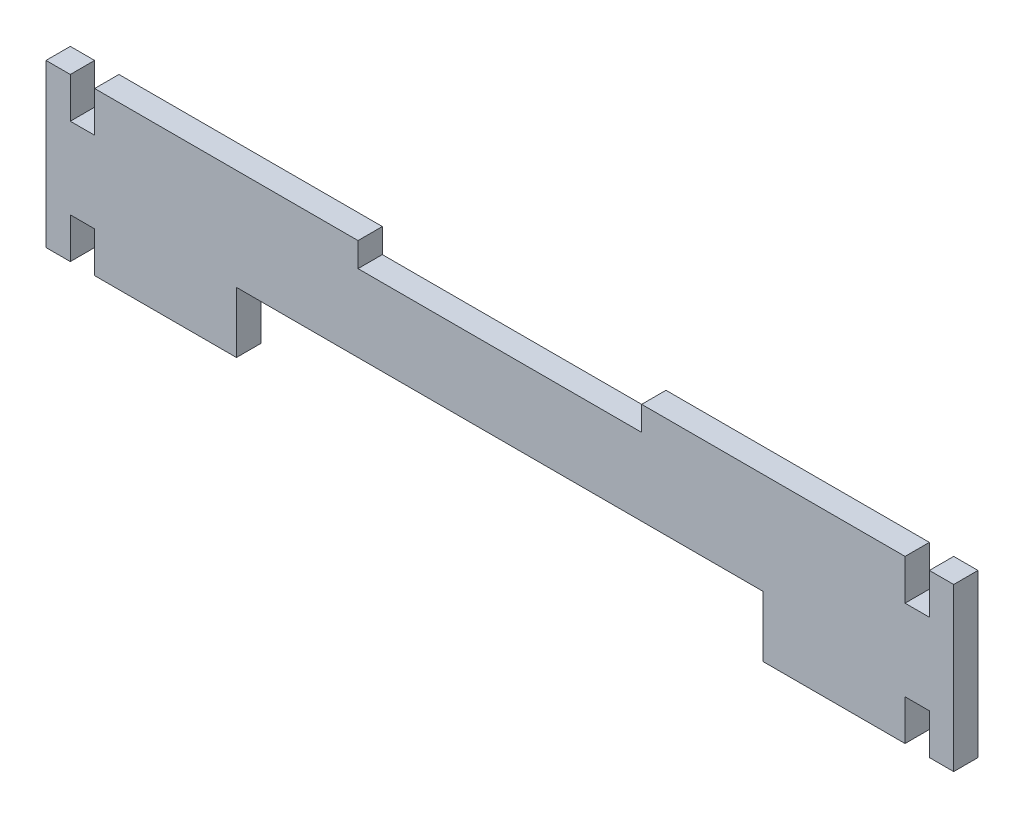
from build123d import *

# Parameters (mm, degrees)
SKETCH1_W            = 224
SKETCH1_H            = 40
BOSS_EXTRUDE1_DEPTH  = 6
SKETCH2_W            = 6
SKETCH2_H            = 10
CUT_EXTRUDE1_DEPTH   = 228.622494495
LPATTERN1_COUNT      = 2
LPATTERN1_PITCH      = 206
LPATTERN1_COUNT_DIR2 = 2
LPATTERN1_PITCH_DIR2 = 30
SKETCH3_W            = 70
SKETCH3_H            = 6
CUT_EXTRUDE2_DEPTH   = 228.622494495
SKETCH4_W            = 130
SKETCH4_H            = 15
CUT_EXTRUDE3_DEPTH   = 10


with BuildPart() as part:
    # Sketch1 → Boss-Extrude1 (new body)
    with BuildSketch(Plane.XY):
        with Locations((-112, 20)):
            Rectangle(SKETCH1_W, SKETCH1_H)
    extrude(amount=BOSS_EXTRUDE1_DEPTH)

    # Sketch2 → Cut-Extrude1 (cut, through all)
    with BuildSketch(Plane.XY.offset(6)):
        with Locations((-215, 35)):
            Rectangle(SKETCH2_W, SKETCH2_H)
    cut_extrude1 = extrude(amount=-CUT_EXTRUDE1_DEPTH, mode=Mode.SUBTRACT)

    # LPattern1: Cut-Extrude1 2 × 2
    with Locations(*[(i * LPATTERN1_PITCH, -j * LPATTERN1_PITCH_DIR2, 0) for i in range(LPATTERN1_COUNT) for j in range(LPATTERN1_COUNT_DIR2) if (i, j) != (0, 0)]):
        add(cut_extrude1, mode=Mode.SUBTRACT)

    # Sketch3 → Cut-Extrude2 (cut, through all)
    with BuildSketch(Plane.XY.offset(6)):
        with Locations((-112, 37)):
            Rectangle(SKETCH3_W, SKETCH3_H)
    extrude(amount=-CUT_EXTRUDE2_DEPTH, mode=Mode.SUBTRACT)

    # Sketch4 → Cut-Extrude3 (cut)
    with BuildSketch(Plane.XY.offset(6)):
        with Locations((-112, 7.5)):
            Rectangle(SKETCH4_W, SKETCH4_H)
    extrude(amount=-CUT_EXTRUDE3_DEPTH, mode=Mode.SUBTRACT)


solid = part.part
